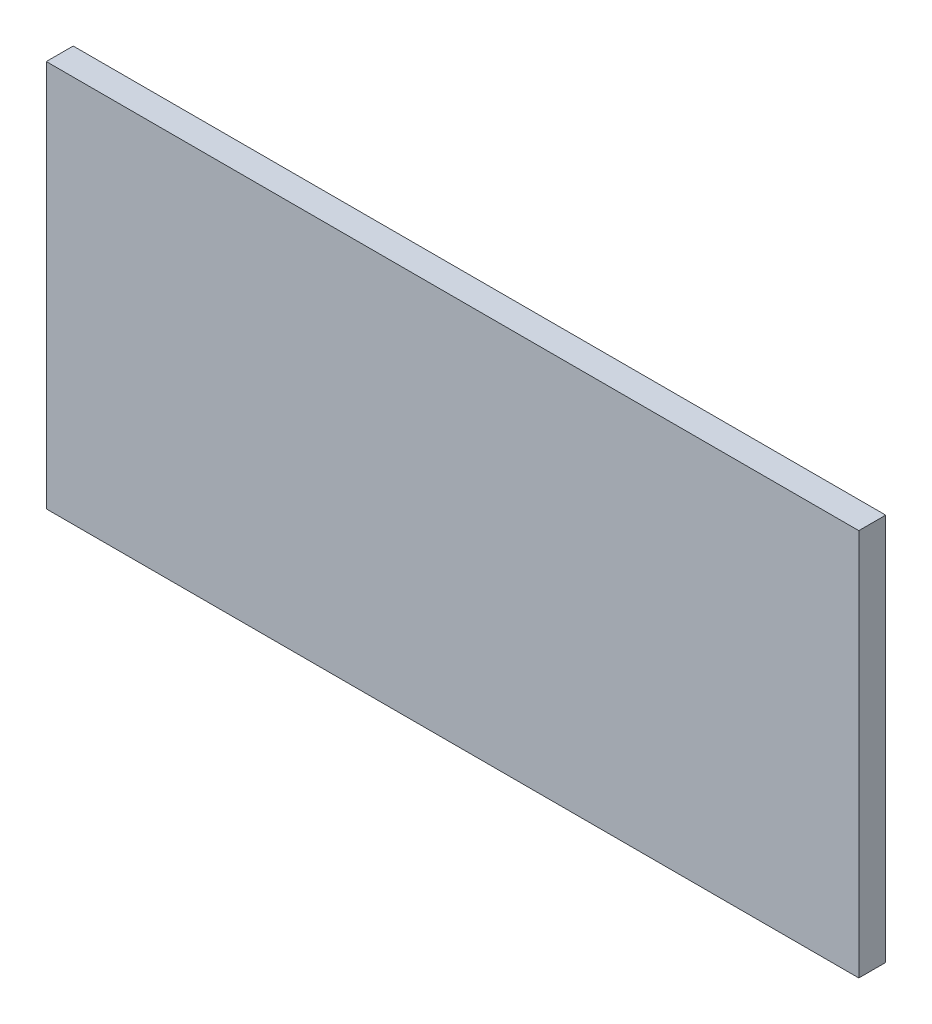
from build123d import *

# Parameters (mm, degrees)
SKETCH1_W           = 151
SKETCH1_H           = 72
BOSS_EXTRUDE1_DEPTH = 5


with BuildPart() as part:
    # Sketch1 → Boss-Extrude1 (new body)
    with BuildSketch(Plane.XY):
        Rectangle(SKETCH1_W, SKETCH1_H)
    extrude(amount=BOSS_EXTRUDE1_DEPTH)


solid = part.part
